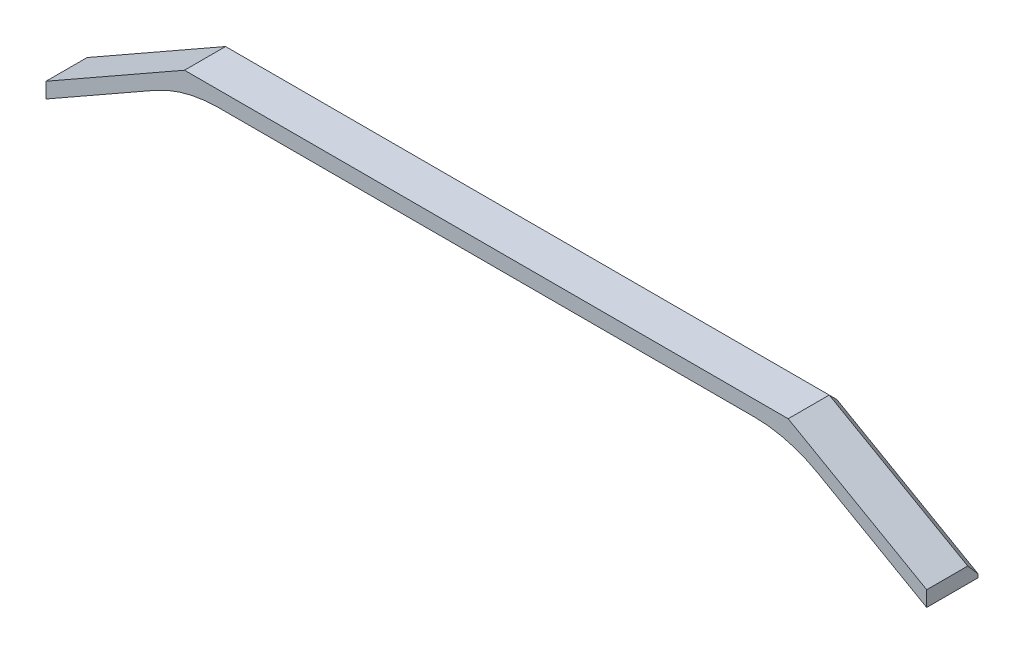
from build123d import *

# Parameters (mm, degrees)
SKETCH1_W           = 117.660256
SKETCH1_H           = 10
BOSS_EXTRUDE1_DEPTH = 3
CHAMFER1_SIZE       = 2
BOSS_EXTRUDE2_START = -3
SKETCH2_R           = 1.5
BOSS_EXTRUDE2_DEPTH = 2
CHAMFER2_SIZE       = 0.3
BOSS_EXTRUDE3_DEPTH = 10
CHAMFER3_SIZE       = 2
FILLET1_R           = 25


with BuildPart() as part:
    # Sketch1 → Boss-Extrude1 (new body)
    with BuildSketch(Plane(origin=(0, 0, 0), x_dir=(1, 0, 0), z_dir=(0, 1, 0))):
        with Locations((0, 5)):
            Rectangle(SKETCH1_W, SKETCH1_H)
    extrude(amount=BOSS_EXTRUDE1_DEPTH)

    # Chamfer1
    chamfer1_edges = [part.edges().sort_by_distance(p)[0] for p in [
        (0, 3, -10),
    ]]
    chamfer(chamfer1_edges, length=CHAMFER1_SIZE)

    # Sketch2 → Boss-Extrude2 (add)
    with BuildSketch(Plane(origin=(0, 3, 0), x_dir=(1, 0, 0), z_dir=(0, 1, 0)).offset(BOSS_EXTRUDE2_START)):
        with Locations(Location((-29, 5, 0), (0, 0, 90))):
            Circle(SKETCH2_R)
        with Locations(Location((29, 5, 0), (0, 0, 90))):
            Circle(SKETCH2_R)
    extrude(amount=-BOSS_EXTRUDE2_DEPTH)

    # Chamfer2
    chamfer2_edges = [part.edges().sort_by_distance(p)[0] for p in [
        (-29, -2, -3.5),
        (29, -2, -3.5),
    ]]
    chamfer(chamfer2_edges, length=CHAMFER2_SIZE)

    # Sketch3 → Boss-Extrude3 (add)
    with BuildSketch(Plane.XY):
        Polygon((-58.830128, 0), (-85.830128, -15.361572), (-85.830128, -12.361572), (-58.830128, 3), align=None)
        Polygon((58.830128, 3), (58.830128, 0), (85.830128, -15.361572), (85.830128, -12.361572), align=None)
    extrude(amount=-BOSS_EXTRUDE3_DEPTH)

    # Chamfer3
    chamfer3_edges = [part.edges().sort_by_distance(p)[0] for p in [
        (72.330128, -4.680786, -10),
        (-72.330128, -4.680786, -10),
    ]]
    chamfer(chamfer3_edges, length=CHAMFER3_SIZE)

    # Fillet1
    fillet1_edges = [part.edges().sort_by_distance(p)[0] for p in [
        (-58.830128, 0, -5),
        (58.830128, 0, -5),
    ]]
    fillet(fillet1_edges, radius=FILLET1_R)


solid = part.part
